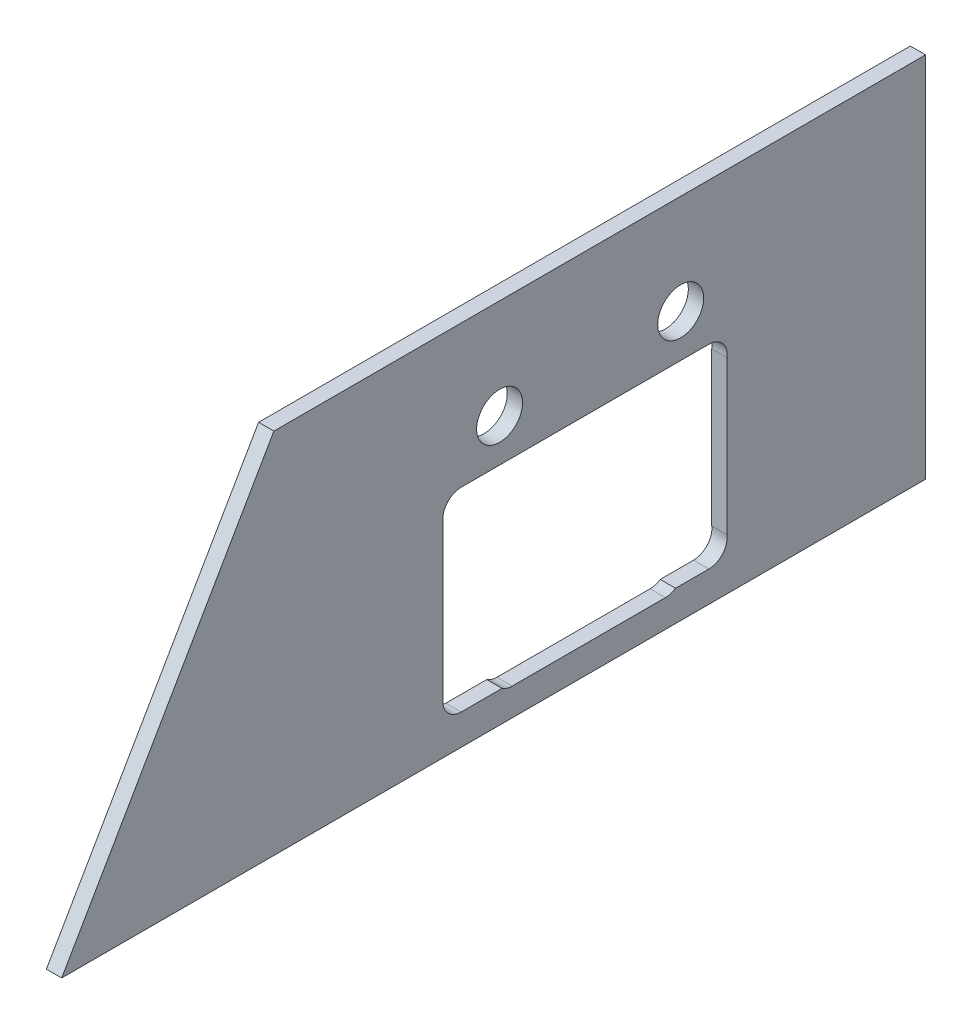
from build123d import *

# Parameters (mm, degrees)
EXTRUDE_1_DEPTH     = 1
CUT_EXTRUDE_1_DEPTH = 35.313434576
SKETCH_5_R          = 1.5
CUT_EXTRUDE_2_DEPTH = 35.313434576
CUT_EXTRUDE1_DEPTH  = 1


with BuildPart() as part:
    # Эскиз1 → Бобышка-Вытянуть1 (new body)
    with BuildSketch(Plane(origin=(0, 0, 0), x_dir=(0, 0, -1), z_dir=(1, 0, 0))):
        Polygon((28.216339104, 4.507181273), (28.216339104, -19.5), (-28.216339104, -19.5), (-14.355786533, 4.507181273), align=None)
    extrude(amount=EXTRUDE_1_DEPTH)

    # Эскиз3 → Вырез-Вытянуть1 (cut, through all)
    with BuildSketch(Plane.ZY):
        with BuildLine():
            Line((-1.216339104, -7.8), (-11.216339104, -7.8))
            ThreePointArc((-11.216339104, -7.8), (-12.064867241, -8.151471863), (-12.416339104, -9))
            Line((-12.416339104, -9), (-12.416339104, -16.5))
            ThreePointArc((-12.416339104, -16.5), (-12.064867241, -17.348528137), (-11.216339104, -17.7))
            Line((-11.216339104, -17.7), (-1.216339104, -17.7))
            ThreePointArc((-1.216339104, -17.7), (-0.367810966, -17.348528137), (-0.016339104, -16.5))
            Line((-0.016339104, -16.5), (-0.016339104, -9))
            ThreePointArc((-0.016339104, -9), (-0.367810966, -8.151471863), (-1.216339104, -7.8))
        make_face()
    extrude(amount=-CUT_EXTRUDE_1_DEPTH, mode=Mode.SUBTRACT)

    # Эскиз5 → Вырез-Вытянуть2 (cut, through all)
    with BuildSketch(Plane.ZY):
        with Locations((-12.216339104, -2)):
            Circle(SKETCH_5_R)
        with Locations((-0.387535442, -2)):
            Circle(SKETCH_5_R)
    extrude(amount=-CUT_EXTRUDE_2_DEPTH, mode=Mode.SUBTRACT)

    # Sketch2 → Cut-Extrude1 (cut)
    with BuildSketch(Plane(origin=(1, 0, 0), x_dir=(0, 0, -1), z_dir=(1, 0, 0))):
        with BuildLine():
            Line((14.058648973, -4.786), (-2.125047218, -4.786))
            ThreePointArc((-2.125047218, -4.786), (-3.018111901, -5.192151072), (-3.309660896, -6.12891273))
            Line((-3.309660896, -6.12891273), (-3.309660896, -16.154222982))
            ThreePointArc((-3.309660896, -16.154222982), (-3.019412686, -17.092766498), (-2.125394323, -17.5))
            Line((-2.125394323, -17.5), (14.058301867, -17.5))
            ThreePointArc((14.058301867, -17.5), (14.95365068, -17.095122111), (15.246339104, -16.157087417))
            Line((15.246339104, -16.157087417), (15.246339104, -6.131777166))
            ThreePointArc((15.246339104, -6.131777166), (14.95495311, -5.191959061), (14.058648973, -4.786))
        make_face()
    extrude(amount=-CUT_EXTRUDE1_DEPTH, mode=Mode.SUBTRACT)


solid = part.part
